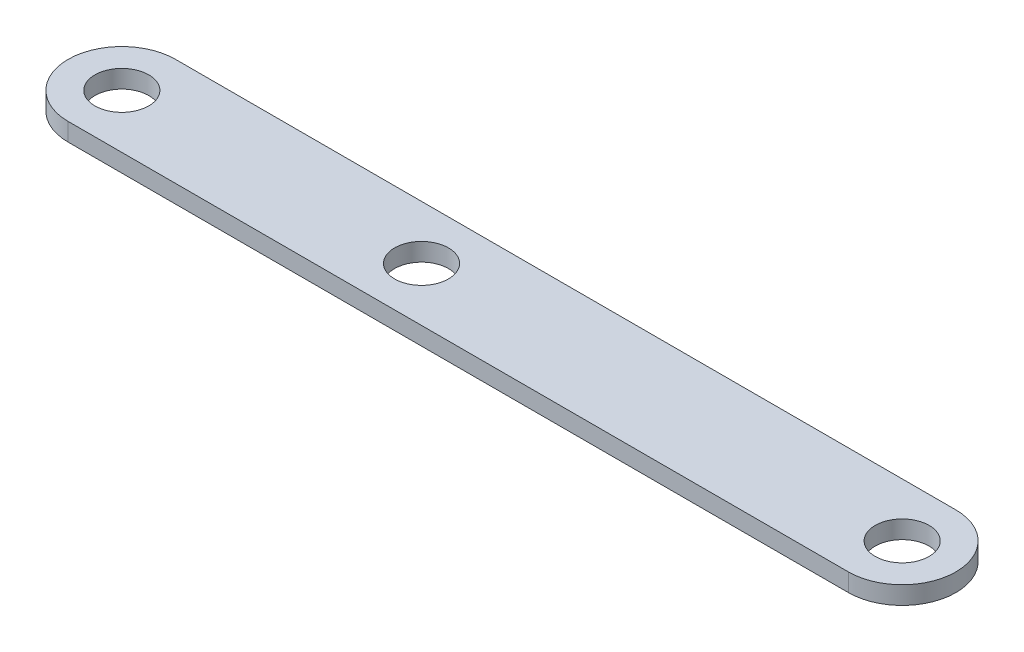
from build123d import *

# Parameters (mm, degrees)
SKETCH1_R           = 4.7625
BOSS_EXTRUDE1_DEPTH = 3.175


with BuildPart() as part:
    # Sketch1 → Boss-Extrude1 (new body)
    with BuildSketch(Plane(origin=(0, 0, 0), x_dir=(1, 0, 0), z_dir=(0, 1, 0))):
        with BuildLine():
            Line((0, 0), (138, 0))
            ThreePointArc((138, 0), (147.5, 9.5), (138, 19))
            Line((138, 19), (0, 19))
            ThreePointArc((0, 19), (-9.5, 9.5), (0, 0))
        make_face()
        with Locations(Location((0, 9.5, 0), (0, 0, 270))):
            Circle(SKETCH1_R, mode=Mode.SUBTRACT)
        with Locations(Location((138, 9.5, 0), (0, 0, 270))):
            Circle(SKETCH1_R, mode=Mode.SUBTRACT)
        with Locations(Location((53, 9.5, 0), (0, 0, 270))):
            Circle(SKETCH1_R, mode=Mode.SUBTRACT)
    extrude(amount=BOSS_EXTRUDE1_DEPTH)


solid = part.part
